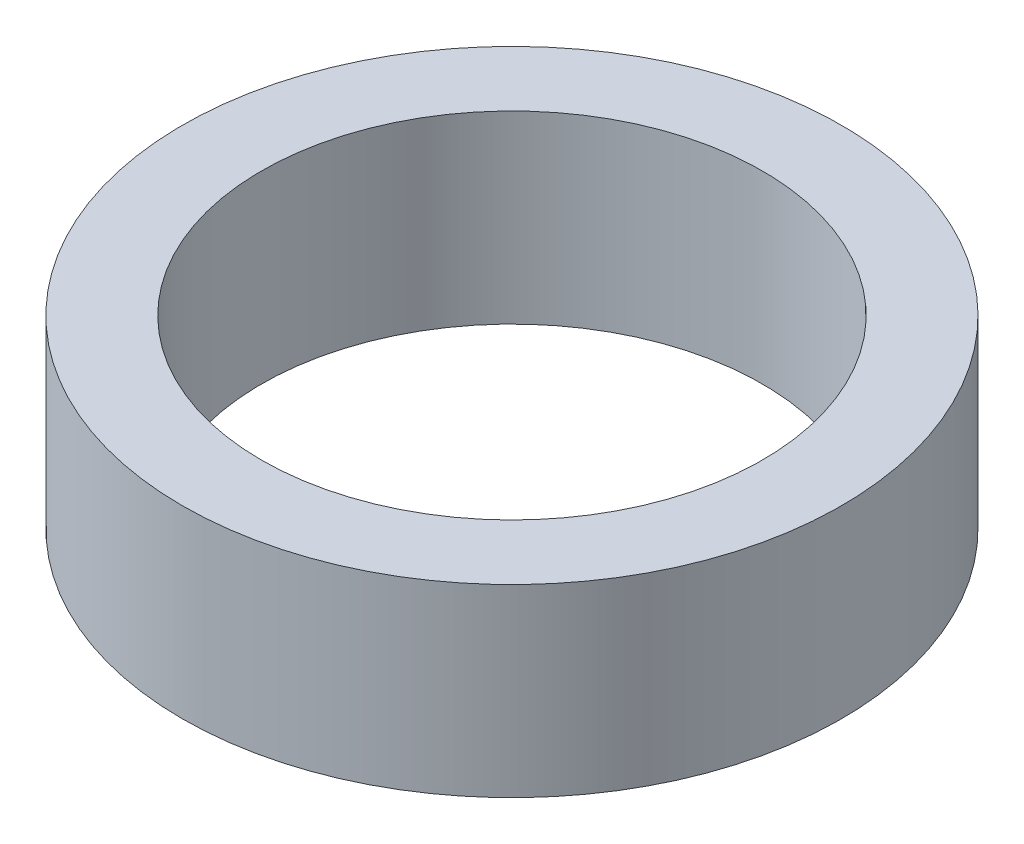
from build123d import *

# Parameters (mm, degrees)
SKETCH1_R           = 6.25
SKETCH1_R_2         = 4.75
BOSS_EXTRUDE1_DEPTH = 3.5


with BuildPart() as part:
    # Sketch1 → Boss-Extrude1 (new body)
    with BuildSketch(Plane(origin=(0, 0, 0), x_dir=(1, 0, 0), z_dir=(0, 1, 0))):
        with Locations(Location((0, 0, 0), (0, 0, 270))):
            Circle(SKETCH1_R)
        with Locations(Location((0, 0, 0), (0, 0, 270))):
            Circle(SKETCH1_R_2, mode=Mode.SUBTRACT)
    extrude(amount=BOSS_EXTRUDE1_DEPTH)


solid = part.part
